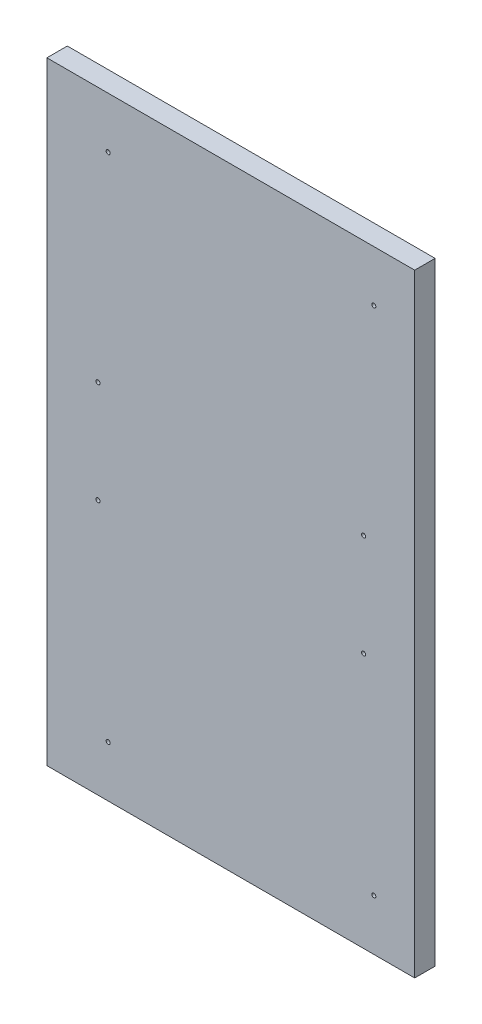
from build123d import *

# Parameters (mm, degrees)
SKETCH_1_W      = 180
SKETCH_1_H      = 300
EXTRUDE_1_DEPTH = 10
F_2_0MM_1_D     = 2
F_2_0MM_1_DEPTH = 6.399139381
F_2_0MM_1_TIP   = 0.600860619
F_2_0MM_2_D     = 2
F_2_0MM_2_DEPTH = 6.399139381
F_2_0MM_2_TIP   = 0.600860619
F_2_0MM_3_D     = 2
F_2_0MM_3_DEPTH = 6.399139381
F_2_0MM_3_TIP   = 0.600860619
F_2_0MM_4_D     = 2
F_2_0MM_4_DEPTH = 6.399139381
F_2_0MM_4_TIP   = 0.600860619


with BuildPart() as part:
    # 草圖1 → 填料-伸長1 (new body)
    with BuildSketch(Plane.XY):
        Rectangle(SKETCH_1_W, SKETCH_1_H)
    extrude(amount=EXTRUDE_1_DEPTH)

    # Ø2.0mm 定位孔1
    with Locations(Plane(origin=(50, -110, 0), x_dir=(-1, 0, 0), z_dir=(0, 0, -1))):
        with Locations((0, 0), (0, 220), (100, 220), (100, 0)):
            Hole(F_2_0MM_1_D / 2, depth=F_2_0MM_1_DEPTH)
            with Locations((0, 0, -(F_2_0MM_1_DEPTH + F_2_0MM_1_TIP / 2))):  # 118° drill point
                Cone(0, F_2_0MM_1_D / 2, F_2_0MM_1_TIP, mode=Mode.SUBTRACT)

    # Ø2.0mm 定位孔2
    with Locations(Plane(origin=(-60, 125, 10), x_dir=(1, 0, 0), z_dir=(0, 0, 1))):
        with Locations((0, 0), (130, 0), (130, -250), (0, -250)):
            Hole(F_2_0MM_2_D / 2, depth=F_2_0MM_2_DEPTH)
            with Locations((0, 0, -(F_2_0MM_2_DEPTH + F_2_0MM_2_TIP / 2))):  # 118° drill point
                Cone(0, F_2_0MM_2_D / 2, F_2_0MM_2_TIP, mode=Mode.SUBTRACT)

    # Ø2.0mm 定位孔3
    with Locations(Plane(origin=(-65, 25, 10), x_dir=(1, 0, 0), z_dir=(0, 0, 1))):
        with Locations((0, 0), (130, 0), (130, -50), (0, -50)):
            Hole(F_2_0MM_3_D / 2, depth=F_2_0MM_3_DEPTH)
            with Locations((0, 0, -(F_2_0MM_3_DEPTH + F_2_0MM_3_TIP / 2))):  # 118° drill point
                Cone(0, F_2_0MM_3_D / 2, F_2_0MM_3_TIP, mode=Mode.SUBTRACT)

    # Ø2.0mm 定位孔4
    with Locations(Plane(origin=(0, 140, 0), x_dir=(-1, 0, 0), z_dir=(0, 0, -1))):
        with Locations((0, 0), (0, -17.2), (0, -262.8), (0, -280)):
            Hole(F_2_0MM_4_D / 2, depth=F_2_0MM_4_DEPTH)
            with Locations((0, 0, -(F_2_0MM_4_DEPTH + F_2_0MM_4_TIP / 2))):  # 118° drill point
                Cone(0, F_2_0MM_4_D / 2, F_2_0MM_4_TIP, mode=Mode.SUBTRACT)


solid = part.part
